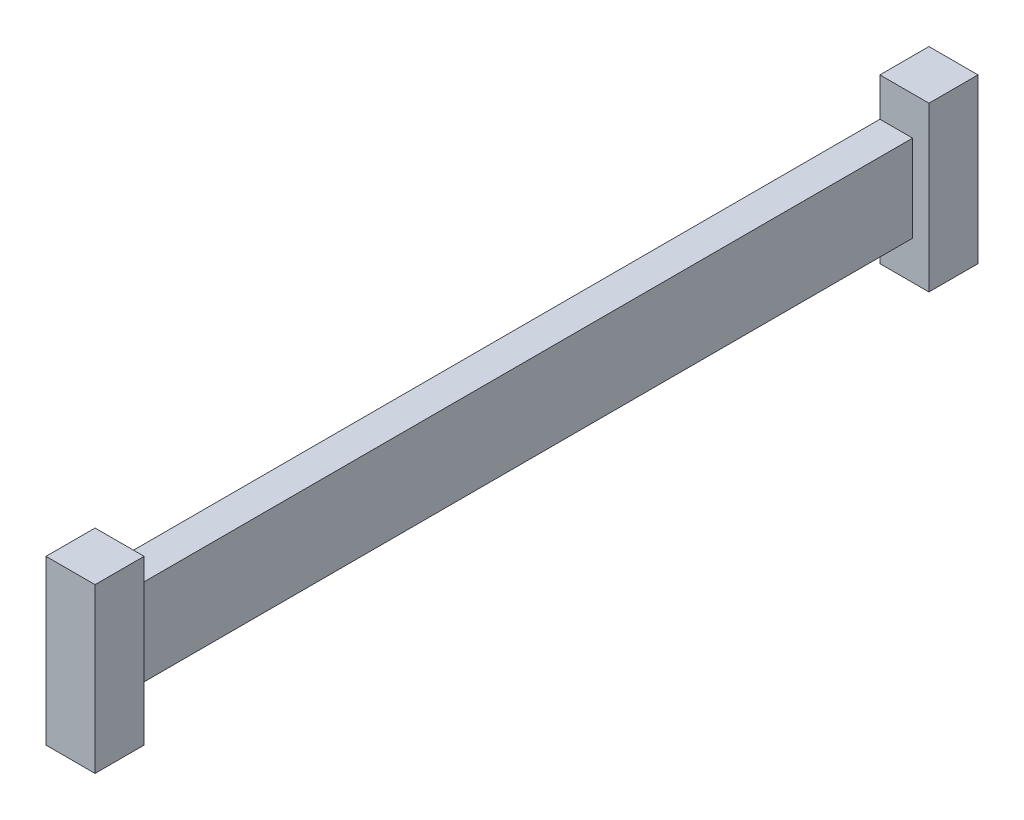
from build123d import *

# Parameters (mm, degrees)
BOSS_EXTRUDE1_DEPTH = 3
SKETCH2_W           = 48
SKETCH2_H           = 5.3
CUT_EXTRUDE1_DEPTH  = 1


with BuildPart() as part:
    # Sketch1 → Boss-Extrude1 (new body)
    with BuildSketch(Plane(origin=(0, 0, 0), x_dir=(0, 0, -1), z_dir=(1, 0, 0))):
        Polygon((0, 0), (0, 10), (3, 10), (3, 7.65), (51, 7.65), (51, 10), (54, 10), (54, 0), (51, 0), (51, 2.35), (3, 2.35), (3, 0), align=None)
    extrude(amount=BOSS_EXTRUDE1_DEPTH)

    # Sketch2 → Cut-Extrude1 (cut)
    with BuildSketch(Plane(origin=(3, 0, 0), x_dir=(0, 0, -1), z_dir=(1, 0, 0))):
        with Locations((27, 5)):
            Rectangle(SKETCH2_W, SKETCH2_H)
    extrude(amount=-CUT_EXTRUDE1_DEPTH, mode=Mode.SUBTRACT)


solid = part.part
